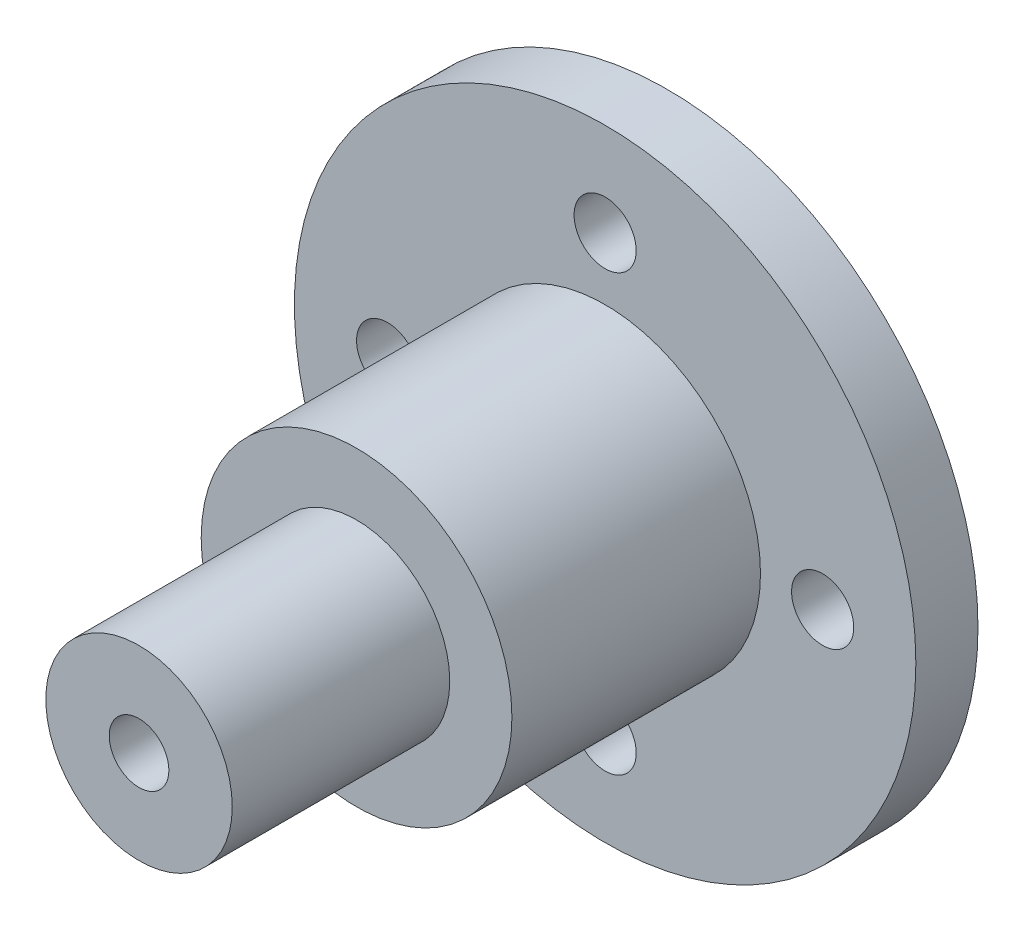
from build123d import *

# Parameters (mm, degrees)
SKETCH1_R           = 25
SKETCH1_R_2         = 2.5
SKETCH1_R_3         = 10
BOSS_EXTRUDE1_DEPTH = 5
SKETCH2_R           = 12.5
BOSS_EXTRUDE2_DEPTH = 20
SKETCH3_R           = 7.5
BOSS_EXTRUDE3_DEPTH = 17.5
SKETCH4_R           = 2.4
CUT_EXTRUDE1_DEPTH  = 10


with BuildPart() as part:
    # Sketch1 → Boss-Extrude1 (new body)
    # profile 1 of 2: a face of its own
    with BuildSketch(Plane.XY):
        Circle(SKETCH1_R)
        with Locations((-17.5, 0)):
            Circle(SKETCH1_R_2, mode=Mode.SUBTRACT)
        with Locations((0, -17.5)):
            Circle(SKETCH1_R_2, mode=Mode.SUBTRACT)
        with Locations((17.5, 0)):
            Circle(SKETCH1_R_2, mode=Mode.SUBTRACT)
        with Locations((0, 17.5)):
            Circle(SKETCH1_R_2, mode=Mode.SUBTRACT)
        Circle(SKETCH1_R_3, mode=Mode.SUBTRACT)
    # profile 2 of 2: a face of its own
    with BuildSketch(Plane.XY):
        Circle(SKETCH1_R_3)
    extrude(amount=BOSS_EXTRUDE1_DEPTH)

    # Sketch2 → Boss-Extrude2 (add)
    with BuildSketch(Plane.XY.offset(5)):
        Circle(SKETCH2_R)
    extrude(amount=BOSS_EXTRUDE2_DEPTH)

    # Sketch3 → Boss-Extrude3 (add)
    with BuildSketch(Plane.XY.offset(25)):
        Circle(SKETCH3_R)
    extrude(amount=BOSS_EXTRUDE3_DEPTH)

    # Sketch4 → Cut-Extrude1 (cut)
    with BuildSketch(Plane.XY.offset(42.5)):
        Circle(SKETCH4_R)
    extrude(amount=-CUT_EXTRUDE1_DEPTH, mode=Mode.SUBTRACT)


solid = part.part
